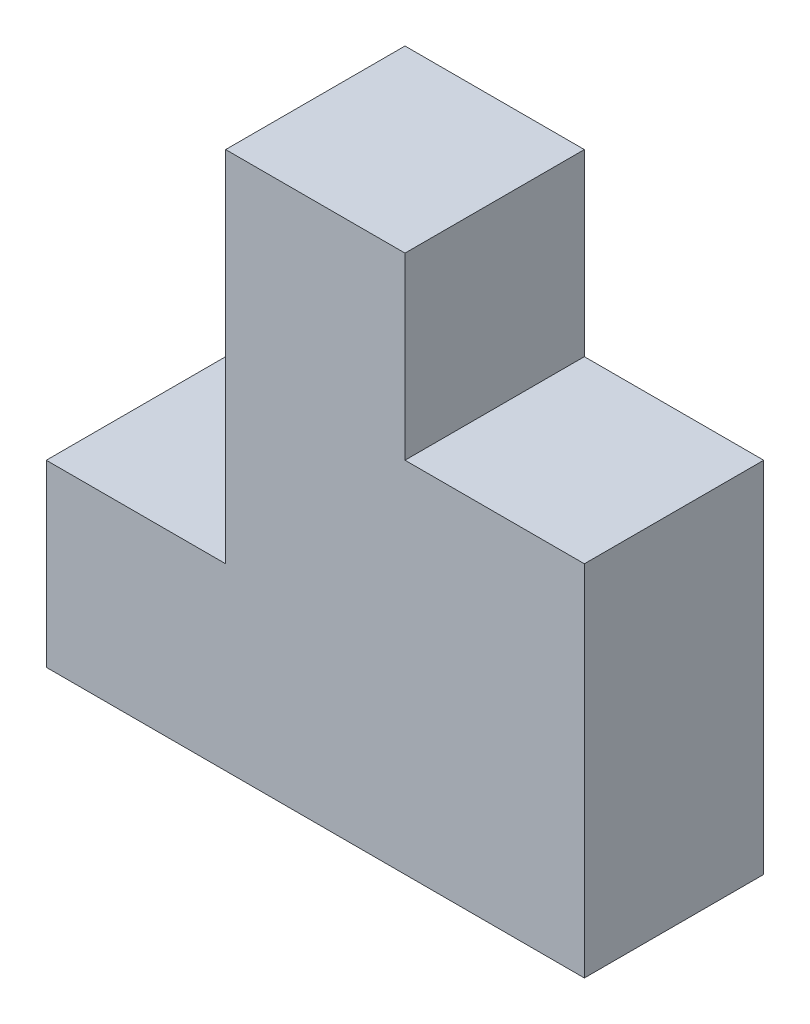
from build123d import *

# Parameters (mm, degrees)
BOSS_EXTRUDE1_DEPTH = 19.05


with BuildPart() as part:
    # Sketch1 → Boss-Extrude1 (new body)
    with BuildSketch(Plane.XY):
        Polygon((0, 0), (57.15, 0), (57.15, 38.1), (38.1, 38.1), (38.1, 57.15), (19.05, 57.15), (19.05, 19.05), (0, 19.05), align=None)
    extrude(amount=BOSS_EXTRUDE1_DEPTH)


solid = part.part
